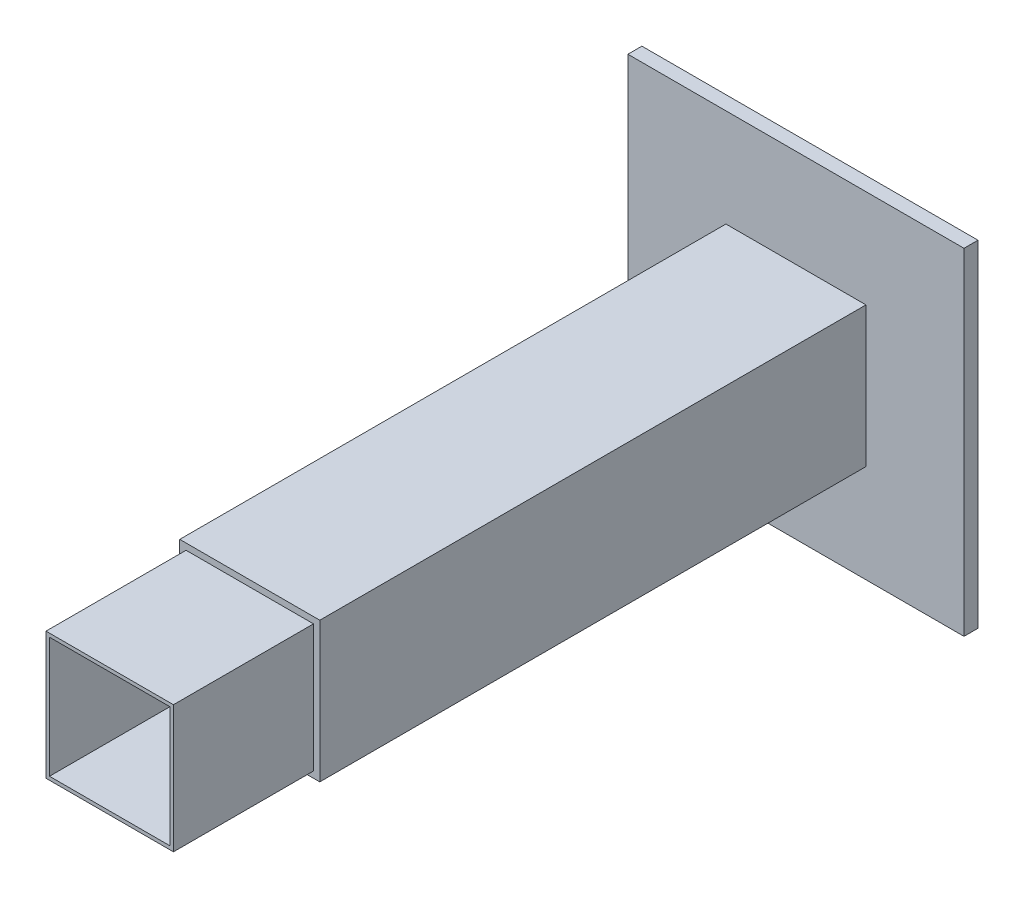
from build123d import *

# Parameters (mm, degrees)
SKETCH_1_W          = 120
SKETCH_1_H          = 120
EXTRUDE_1_DEPTH     = 5
SKETCH_2_W          = 50
SKETCH_2_H          = 50
EXTRUDE_2_DEPTH     = 245
SKETCH_3_W          = 43
SKETCH_3_H          = 43
CUT_EXTRUDE_2_DEPTH = 250
SKETCH_6_W          = 50
SKETCH_6_H          = 50
SKETCH_6_W_2        = 47
SKETCH_6_H_2        = 47
CUT_EXTRUDE_5_DEPTH = 50
SKETCH_7_W          = 47
SKETCH_7_H          = 47
SKETCH_7_W_2        = 45.5
SKETCH_7_H_2        = 45.5
CUT_EXTRUDE_8_DEPTH = 50


with BuildPart() as part:
    # 草图1 → 凸台-拉伸1 (new body)
    with BuildSketch(Plane.XY):
        Rectangle(SKETCH_1_W, SKETCH_1_H)
    extrude(amount=EXTRUDE_1_DEPTH)

    # 草图2 → 凸台-拉伸2 (add)
    with BuildSketch(Plane.XY.offset(5)):
        Rectangle(SKETCH_2_W, SKETCH_2_H)
    extrude(amount=EXTRUDE_2_DEPTH)

    # 草图3 → 切除-拉伸2 (cut)
    with BuildSketch(Plane.XY.offset(250)):
        Rectangle(SKETCH_3_W, SKETCH_3_H)
    extrude(amount=-CUT_EXTRUDE_2_DEPTH, mode=Mode.SUBTRACT)

    # 草图6 → 切除-拉伸5 (cut)
    with BuildSketch(Plane.XY.offset(250)):
        Rectangle(SKETCH_6_W, SKETCH_6_H)
        Rectangle(SKETCH_6_W_2, SKETCH_6_H_2, mode=Mode.SUBTRACT)
    extrude(amount=-CUT_EXTRUDE_5_DEPTH, mode=Mode.SUBTRACT)

    # 草图7 → 切除-拉伸8 (cut)
    with BuildSketch(Plane.XY.offset(250)):
        Rectangle(SKETCH_7_W, SKETCH_7_H)
        Rectangle(SKETCH_7_W_2, SKETCH_7_H_2, mode=Mode.SUBTRACT)
    extrude(amount=-CUT_EXTRUDE_8_DEPTH, mode=Mode.SUBTRACT)


solid = part.part
